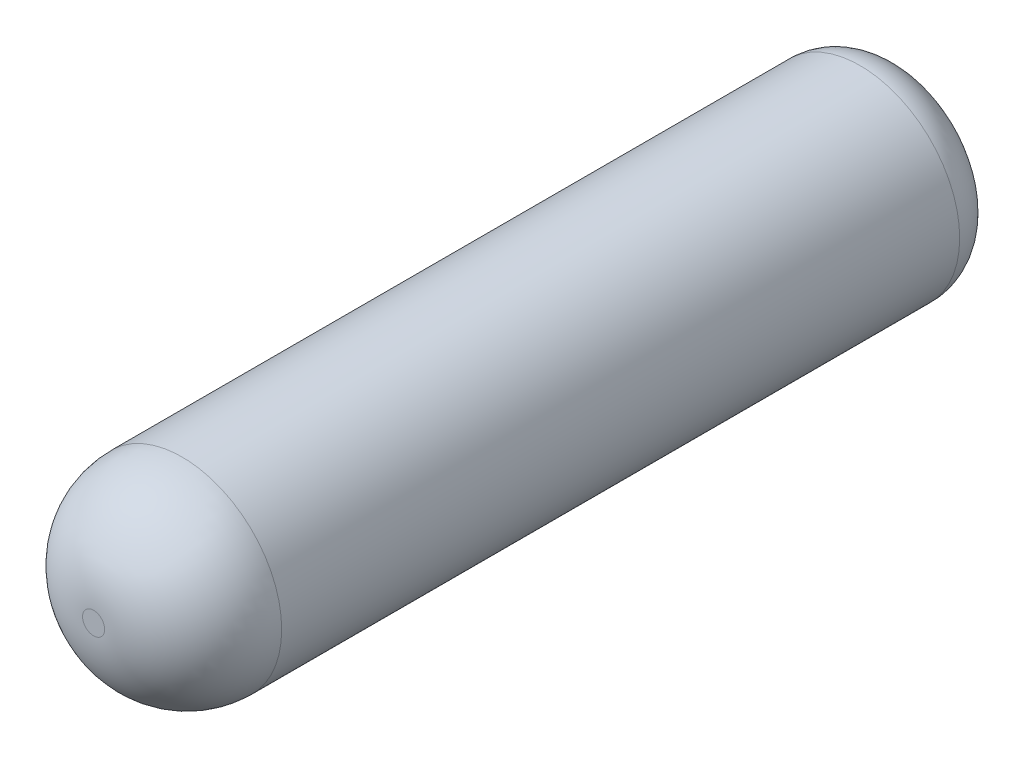
from build123d import *

# Parameters (mm, degrees)
SKETCH1_R           = 14.2875
BOSS_EXTRUDE1_DEPTH = 116.332
FILLET2_R           = 6.35
FILLET3_R           = 12.7


with BuildPart() as part:
    # Sketch1 → Boss-Extrude1 (new body)
    with BuildSketch(Plane.XY):
        with Locations(Location((0, 0, 0), (0, 0, 180))):
            Circle(SKETCH1_R)
    extrude(amount=BOSS_EXTRUDE1_DEPTH)

    # Fillet2
    fillet2_edges = [part.edges().sort_by_distance(p)[0] for p in [
        (14.2875, 0, 0),
    ]]
    fillet(fillet2_edges, radius=FILLET2_R)

    # Fillet3
    fillet3_edges = [part.edges().sort_by_distance(p)[0] for p in [
        (14.2875, 0, 116.332),
    ]]
    fillet(fillet3_edges, radius=FILLET3_R)


solid = part.part
